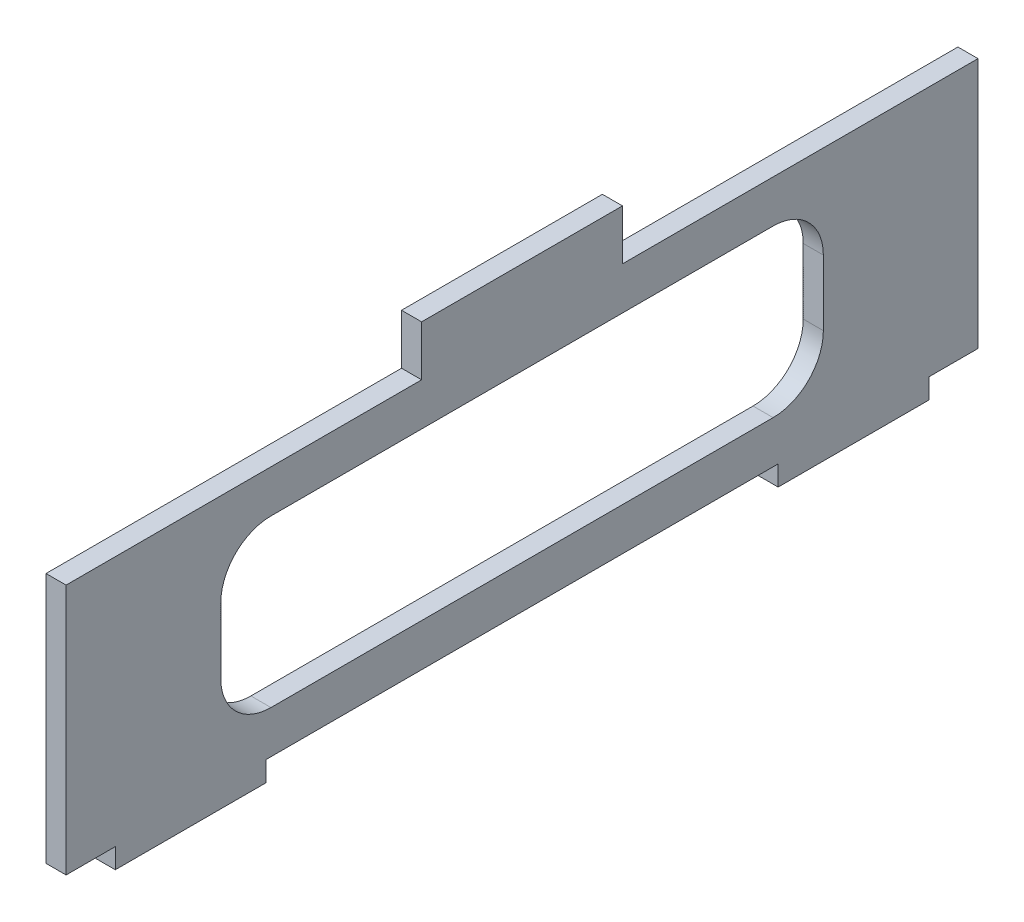
from build123d import *

# Parameters (mm, degrees)
SALIENTE_EXTRUIR1_DEPTH = 4


with BuildPart() as part:
    # Croquis1 → Saliente-Extruir1 (new body)
    with BuildSketch(Plane(origin=(0, 0, 0), x_dir=(0, 0, -1), z_dir=(1, 0, 0))):
        Polygon((-81, -25), (-81, -29), (-51, -29), (-51, -25), (51, -25), (51, -29), (81, -29), (81, -25), (90.8, -25), (90.8, 25), (20, 25), (20, 35), (-20, 35), (-20, 25), (-90.8, 25), (-90.8, -25), align=None)
        with BuildLine():
            Line((-50, 16.519823789), (50, 16.519823789))
            ThreePointArc((50, 16.519823789), (57.071067812, 13.5908916), (60, 6.519823789))
            Line((60, 6.519823789), (60, -6.519823789))
            ThreePointArc((60, -6.519823789), (57.071067812, -13.5908916), (50, -16.519823789))
            Line((50, -16.519823789), (-50, -16.519823789))
            ThreePointArc((-50, -16.519823789), (-57.071067812, -13.5908916), (-60, -6.519823789))
            Line((-60, -6.519823789), (-60, 6.519823789))
            ThreePointArc((-60, 6.519823789), (-57.071067812, 13.5908916), (-50, 16.519823789))
        make_face(mode=Mode.SUBTRACT)
    extrude(amount=SALIENTE_EXTRUIR1_DEPTH)


solid = part.part
